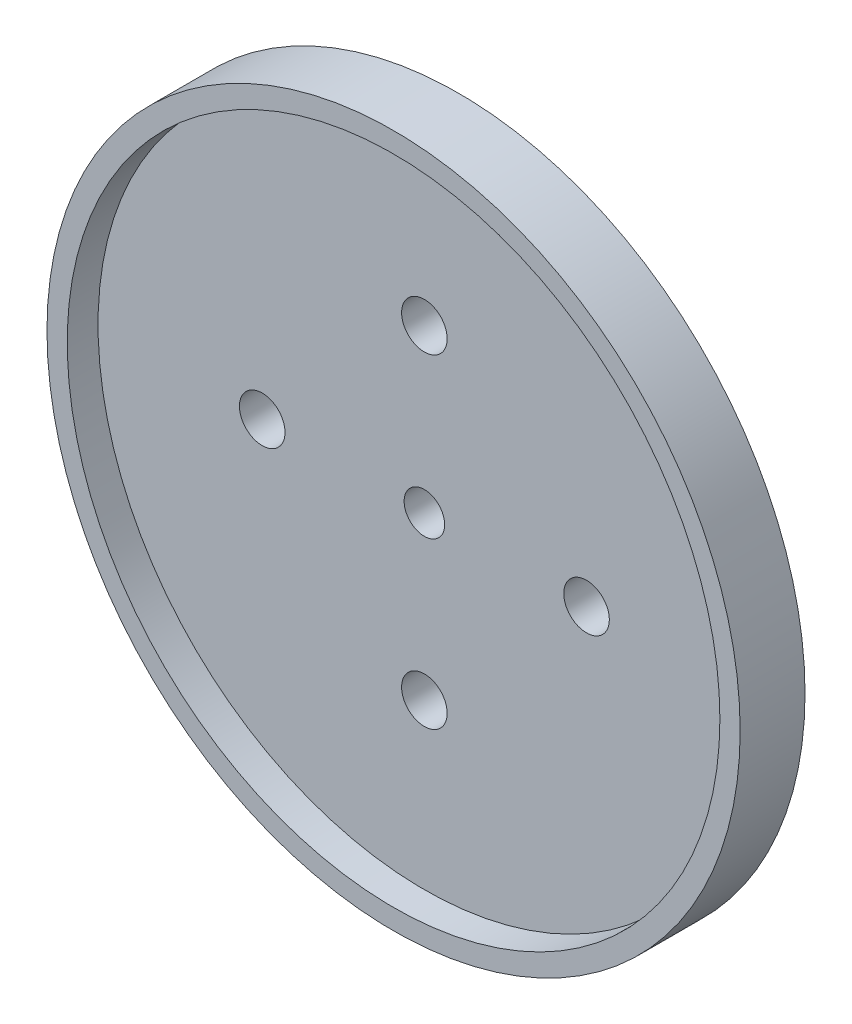
from build123d import *

# Parameters (mm, degrees)
SKETCH1_R                       = 54.2925
EXTRUDE1_DEPTH                  = 10.16
SKETCH2_R                       = 51.1175
EXTRUDE2_DEPTH                  = 4.826
F_1_4_0_25_DIAMETER_HOLE1_D     = 6.35
F_1_4_0_25_DIAMETER_HOLE1_DEPTH = 6.35
F_1_4_0_25_DIAMETER_HOLE1_TIP   = 1.907732465
F_1_4_CLEARANCE_HOLE1_D         = 7.14248
CIRPATTERN1_COUNT               = 4


with BuildPart() as part:
    # Sketch1 → Extrude1 (new body)
    with BuildSketch(Plane.XY):
        Circle(SKETCH1_R)
    extrude(amount=EXTRUDE1_DEPTH)

    # Sketch2 → Extrude2 (cut)
    with BuildSketch(Plane.XY.offset(10.16)):
        Circle(SKETCH2_R)
    extrude(amount=-EXTRUDE2_DEPTH, mode=Mode.SUBTRACT)

    # 1/4 (0.25) Diameter Hole1
    with Locations(Plane.XY.offset(5.334)):
        with Locations((0, 0)):
            Hole(F_1_4_0_25_DIAMETER_HOLE1_D / 2, depth=F_1_4_0_25_DIAMETER_HOLE1_DEPTH)
            with Locations((0, 0, -(F_1_4_0_25_DIAMETER_HOLE1_DEPTH + F_1_4_0_25_DIAMETER_HOLE1_TIP / 2))):  # 118° drill point
                Cone(0, F_1_4_0_25_DIAMETER_HOLE1_D / 2, F_1_4_0_25_DIAMETER_HOLE1_TIP, mode=Mode.SUBTRACT)

    # 1/4 Clearance Hole1 (through all)
    with Locations(Plane(origin=(25.4, 0, 5.334), x_dir=(1, 0, 0), z_dir=(0, 0, 1))):
        with Locations((0, 0)):
            f_1_4_clearance_hole1 = Hole(F_1_4_CLEARANCE_HOLE1_D / 2)

    # CirPattern1: 1/4 Clearance Hole1 ×4 about axis
    cirpattern1_axis = Axis((0, 0, 0), (0, 0, 1))
    for i in range(1, CIRPATTERN1_COUNT):
        add(f_1_4_clearance_hole1.rotate(cirpattern1_axis, i * 360 / CIRPATTERN1_COUNT), mode=Mode.SUBTRACT)


solid = part.part
